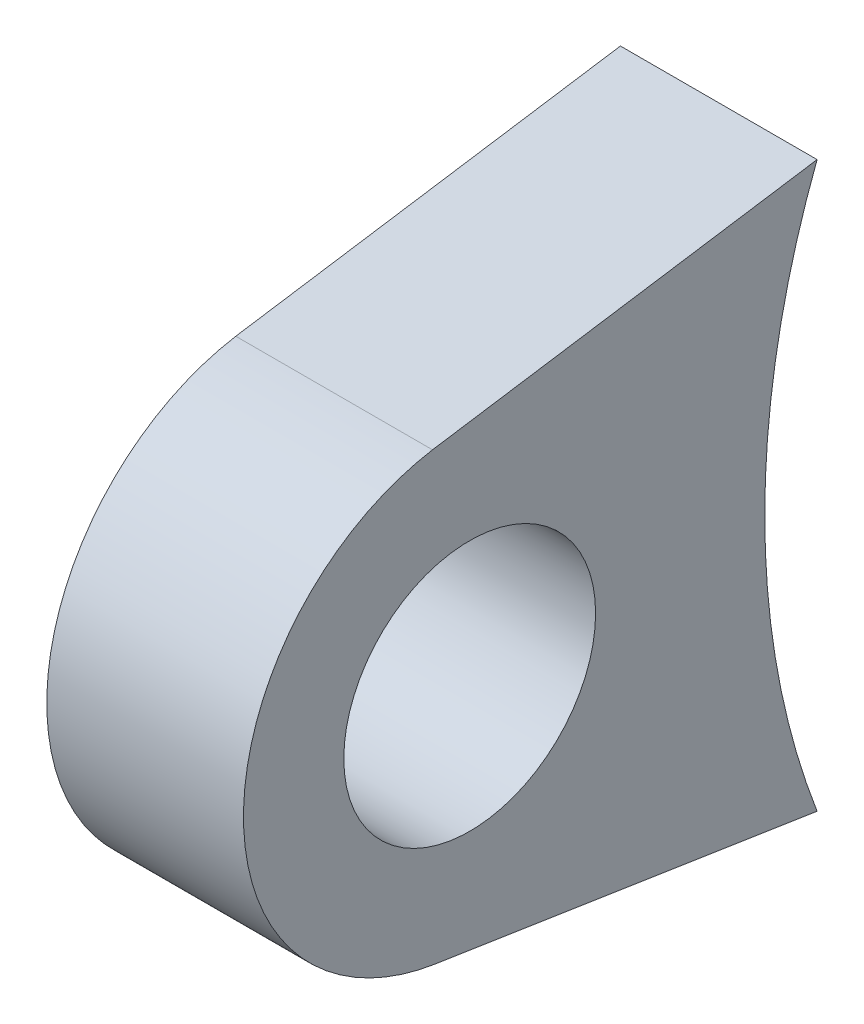
from build123d import *

# Parameters (mm, degrees)
SZKIC19_R                   = 3.2
DODANIE_WYCI_GNI_CIE4_DEPTH = 5


with BuildPart() as part:
    # Szkic19 → Dodanie-wyciągnięcie4 (new body)
    with BuildSketch(Plane(origin=(91.785447504, 0, 0), x_dir=(0, 0, -1), z_dir=(1, 0, 0))):
        with BuildLine():
            ThreePointArc((-28.445954588, 5.671654954), (-33.249878941, -0.037311688), (-28.372269859, -5.683453641))
            Line((-28.372269859, -5.683453641), (-18.66960621, -7.172573037))
            ThreePointArc((-18.66960621, -7.172573037), (-20, 0), (-18.66960621, 7.172573037))
            Line((-18.66960621, 7.172573037), (-28.445954588, 5.671654954))
        make_face()
        with Locations((-27.5, 0)):
            Circle(SZKIC19_R, mode=Mode.SUBTRACT)
    extrude(amount=-DODANIE_WYCI_GNI_CIE4_DEPTH)


solid = part.part
